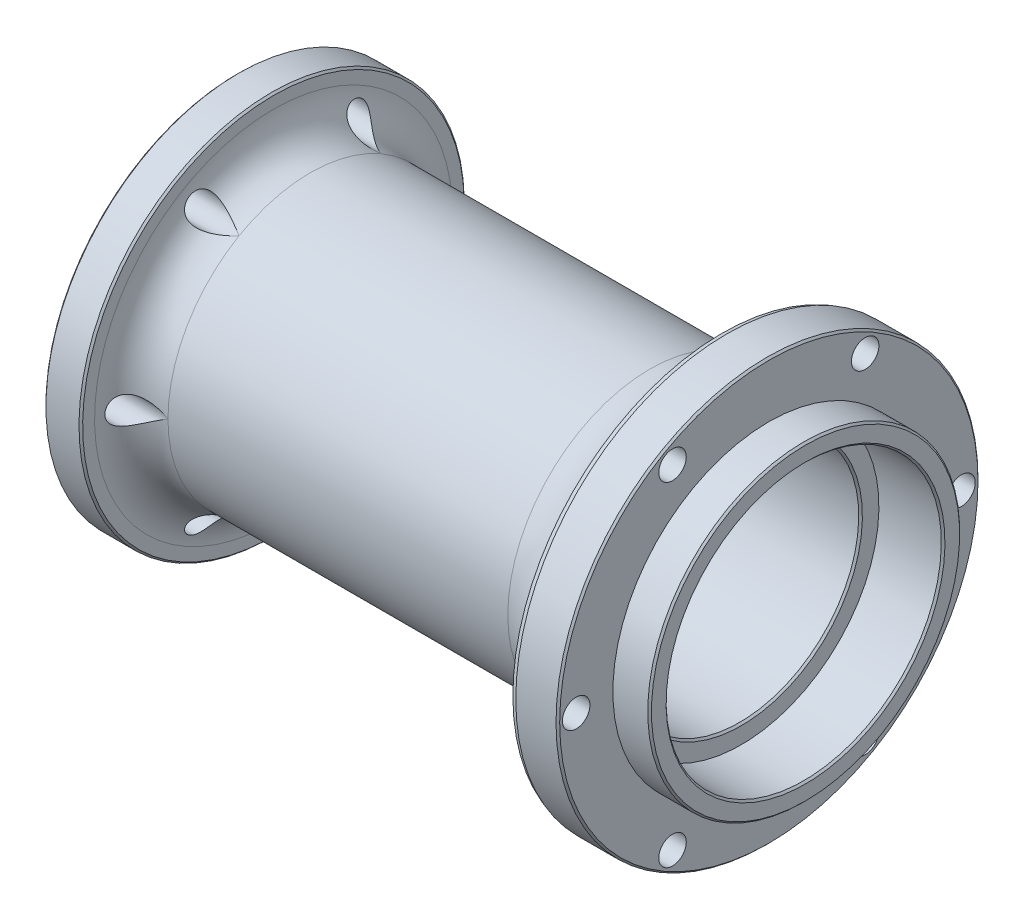
from build123d import *
from OCP.BRepFilletAPI import BRepFilletAPI_MakeChamfer

# Parameters (mm, degrees)
CHAMFER1_SIZE          = 0.2
CHAMFER1_SIZE2         = 0.413488384
M3_TAPPED_HOLE1_REACH  = 72.014
M3_TAPPED_HOLE1_BORE_R = 1.5
CIRPATTERN1_COUNT      = 6


with BuildPart() as part:
    # Sketch1 → Revolve1 (revolve)
    with BuildSketch(Plane.XY):
        with BuildLine():
            Line((-26.521600369, 21), (-22.521600369, 21))
            Line((-22.521600369, 21), (-22.521600369, 19.5))
            ThreePointArc((-22.521600369, 19.5), (-21.350027494, 16.671572875), (-18.521600369, 15.5))
            Line((-18.521600369, 15.5), (18.521600369, 15.5))
            ThreePointArc((18.521600369, 15.5), (22.282697628, 16.596259879), (24.865754878, 19.541672168))
            Line((24.865754878, 19.541672168), (26.478399631, 23))
            Line((26.478399631, 23), (31.478399631, 23))
            Line((31.478399631, 23), (31.478399631, 17))
            Line((31.478399631, 17), (35.478399631, 17))
            Line((35.478399631, 17), (35.478399631, 15))
            Line((35.478399631, 15), (28.478399631, 15))
            Line((28.478399631, 15), (28.478399631, 13))
            Line((28.478399631, 13), (0.478399631, 13))
            Line((0.478399631, 13), (0.478399631, 10))
            Line((0.478399631, 10), (-18.521600369, 10))
            Line((-18.521600369, 10), (-18.521600369, 13))
            Line((-18.521600369, 13), (-26.521600369, 13))
            Line((-26.521600369, 13), (-26.521600369, 21))
        make_face()
    revolve(axis=Axis((19.672711189, 0, 0), (-1, 0, 0)))

    # Chamfer1: one chamfer whose edges measure the first distance from different faces: ONE call of the kernel's chamfer builder (chamfer() names one face for all edges)
    chamfer1_edges_1 = [part.edges().sort_by_distance(p)[0] for p in [
        (-26.521600369, -21, 0),
        (-22.521600369, -21, 0),
        (31.478399631, -23, 0),
        (35.478399631, -17, 0),
        (35.478399631, -15, 0),
        (28.478399631, -13, 0),
        (0.478399631, -10, 0),
        (-18.521600369, -10, 0),
        (-26.521600369, -13, 0),
    ]]
    chamfer1_edges_2 = [part.edges().sort_by_distance(p)[0] for p in [
        (26.478399631, -23, 0),
    ]]
    chamfer1_side_2 = [part.faces().sort_by_distance(p)[0] for p in [
        (25.672077255, -21.270836084, 0),
    ]]
    chamfer1 = BRepFilletAPI_MakeChamfer(part.part.solid().wrapped)
    for e in chamfer1_edges_1:
        chamfer1.Add(CHAMFER1_SIZE, e.wrapped)
    for e in chamfer1_edges_2:
        chamfer1.Add(CHAMFER1_SIZE, CHAMFER1_SIZE2, e.wrapped, chamfer1_side_2[0].wrapped)  # the first distance lies on this face
    add(Compound.cast(chamfer1.Shape()), mode=Mode.REPLACE)

    # M3 Tapped Hole1 bore → M3 Tapped Hole1 (cut, up to next)
    with BuildSketch(Plane.ZY.offset(26.521600369), mode=Mode.PRIVATE) as m3_tapped_hole1_sk1:
        with Locations((-17, 0)):
            Circle(M3_TAPPED_HOLE1_BORE_R)
    m3_tapped_hole1_tool1 = extrude(m3_tapped_hole1_sk1.sketch, amount=-M3_TAPPED_HOLE1_REACH, mode=Mode.PRIVATE) & part.part
    m3_tapped_hole1 = m3_tapped_hole1_tool1.solids().sort_by_distance((-26.5216, 0, -17))[0]
    add(m3_tapped_hole1, mode=Mode.SUBTRACT)

    # Sketch7 → M3 Tapped Hole2 (revolve, cut)
    with BuildSketch(Plane(origin=(31.478399631, 0, 21), x_dir=(0, 0, -1), z_dir=(0, 1, 0))):
        Polygon((0, 0), (0, 9.251075774), (1.25, 8.5), (1.25, 7), (1.5, 7), (1.5, 0), align=None)
    m3_tapped_hole2 = revolve(axis=Axis((37.828399631, 0, 21), (-1, 0, 0)), mode=Mode.SUBTRACT)

    # CirPattern1: M3 Tapped Hole1, M3 Tapped Hole2 ×6 about axis
    cirpattern1_axis = Axis((0, 0, 0), (1, 0, 0))
    add([m3_tapped_hole1.rotate(cirpattern1_axis, i * 360 / CIRPATTERN1_COUNT) for i in range(1, CIRPATTERN1_COUNT)], mode=Mode.SUBTRACT)
    add([m3_tapped_hole2.rotate(cirpattern1_axis, i * 360 / CIRPATTERN1_COUNT) for i in range(1, CIRPATTERN1_COUNT)], mode=Mode.SUBTRACT)


solid = part.part
